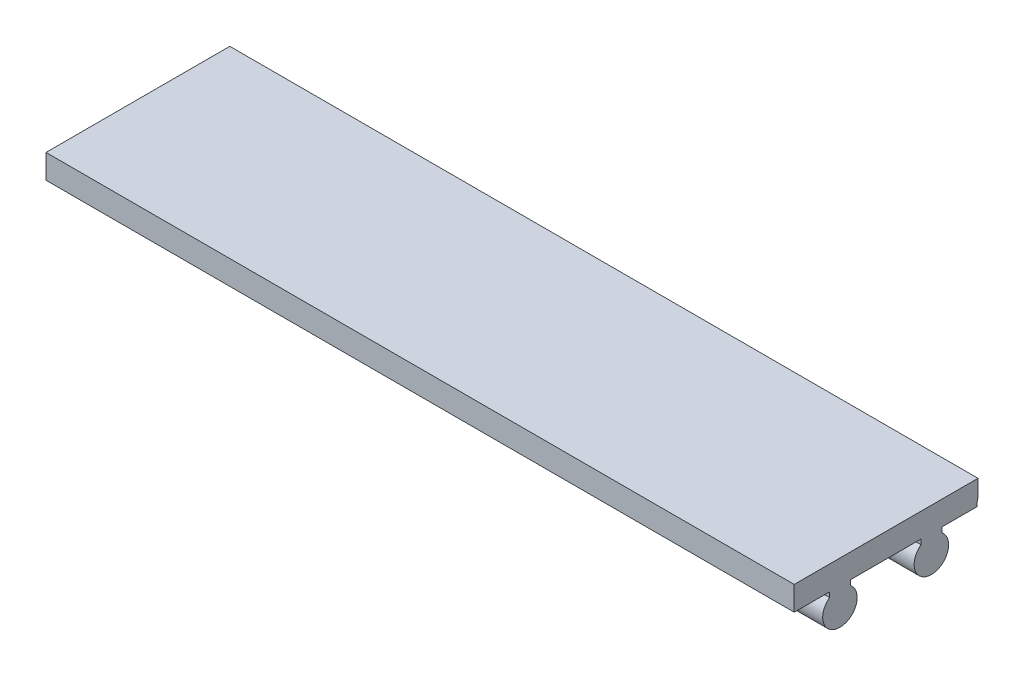
from build123d import *

# Parameters (mm, degrees)
EXTRUDE_1_DEPTH             = 90
SKETCH_2_W                  = 90
SKETCH_2_H                  = 17.75
EXTRUDE_2_DEPTH             = 8.2
SKETCH_3_W                  = 90
SKETCH_3_H                  = 50.95
EXTRUDE_3_DEPTH             = 8.2
SKETCH_4_W                  = 3.95
SKETCH_4_H                  = 29.5
CUT_EXTRUDE_1_DEPTH         = 96.44153315
SKETCH_5_W                  = 3.95
SKETCH_5_H                  = 6.2
CUT_EXTRUDE_2_DEPTH         = 96.44153315
SKETCH_6_W                  = 2.25
SKETCH_6_H                  = 3.95
CUT_EXTRUDE_3_DEPTH         = 96.44153315
SKETCH_7_W                  = 4.5
SKETCH_7_H                  = 3.95
CUT_EXTRUDE_4_DEPTH         = 96.44153315
SKETCH_8_W                  = 2.25
SKETCH_8_H                  = 3.95
CUT_EXTRUDE_5_DEPTH         = 96.44153315
SKETCH_9_W                  = 3.95
SKETCH_9_H                  = 2.25
CUT_EXTRUDE_6_DEPTH         = 96.44153315
SKETCH_10_W                 = 20.2
SKETCH_10_H                 = 45.2
CUT_EXTRUDE_7_DEPTH         = 86
HOLE_WIZARD_2_5_2_5_1_D     = 2.5
HOLE_WIZARD_4_5_4_5_1_D     = 4.5
HOLE_WIZARD_8_3_8_3_1_D     = 8.3
HOLE_WIZARD_8_3_8_3_1_DEPTH = 3.2
FILLET_1_R                  = 2
FILLET_2_R                  = 2
EXTRUDE_START               = -90
SKETCH_17_R                 = 1.25
EXTRUDE_4_DEPTH             = 90
CUT_EXTRUDE_START           = -100
SKETCH_18_R                 = 4.15
CUT_EXTRUDE_8_DEPTH         = 100
CUT_EXTRUDE_9_DEPTH         = 106
SKETCH_20_W                 = 90
SKETCH_20_H                 = 22.108571968
EXTRUDE_5_DEPTH             = 2


with BuildPart() as part:
    # Эскиз1 → Бобышка-Вытянуть1 (new body)
    with BuildSketch(Plane(origin=(90, 0, 0), x_dir=(0, 0, -1), z_dir=(1, 0, 0))):
        with BuildLine():
            Line((6.75, -24.093761792), (6.75, 19.25))
            Line((6.75, 19.25), (-11.593761792, 19.25))
            ThreePointArc((-11.593761792, 19.25), (-15.325, 18), (-11.593761792, 16.75))
            Line((-11.593761792, 16.75), (-11, 16.75))
            Line((-11, 16.75), (-11, -16.75))
            Line((-11, -16.75), (-11.593761792, -16.75))
            ThreePointArc((-11.593761792, -16.75), (-15.325, -18), (-11.593761792, -19.25))
            Line((-11.593761792, -19.25), (-11, -19.25))
            Line((-11, -19.25), (-11, -23.5))
            Line((-11, -23.5), (-6.75, -23.5))
            Line((-6.75, -23.5), (-6.75, -24.093761792))
            ThreePointArc((-6.75, -24.093761792), (-5.5, -27.825), (-4.25, -24.093761792))
            Line((-4.25, -24.093761792), (-4.25, -23.5))
            Line((-4.25, -23.5), (4.25, -23.5))
            Line((4.25, -23.5), (4.25, -24.093761792))
            ThreePointArc((4.25, -24.093761792), (5.5, -27.825), (6.75, -24.093761792))
        make_face()
    extrude(amount=-EXTRUDE_1_DEPTH)

    # Эскиз2 → Бобышка-Вытянуть2 (add)
    with BuildSketch(Plane(origin=(0, 19.25, 0), x_dir=(-1, 0, 0), z_dir=(0, 1, 0))):
        with Locations((-45, 2.125)):
            Rectangle(SKETCH_2_W, SKETCH_2_H)
    extrude(amount=EXTRUDE_2_DEPTH)

    # Эскиз3 → Бобышка-Вытянуть3 (add)
    with BuildSketch(Plane(origin=(0, 0, -6.75), x_dir=(-1, 0, 0), z_dir=(0, 0, -1))):
        with Locations((-45, 1.975)):
            Rectangle(SKETCH_3_W, SKETCH_3_H)
    extrude(amount=EXTRUDE_3_DEPTH)

    # Эскиз4 → Вырез-Вытянуть1 (cut, through all)
    with BuildSketch(Plane.ZY):
        with Locations((-12.975, 0)):
            Rectangle(SKETCH_4_W, SKETCH_4_H)
    extrude(amount=-CUT_EXTRUDE_1_DEPTH, mode=Mode.SUBTRACT)

    # Эскиз5 → Вырез-Вытянуть2 (cut, through all)
    with BuildSketch(Plane.ZY):
        with Locations((-12.975, 24.35)):
            Rectangle(SKETCH_5_W, SKETCH_5_H)
    extrude(amount=-CUT_EXTRUDE_2_DEPTH, mode=Mode.SUBTRACT)

    # Эскиз6 → Вырез-Вытянуть3 (cut, through all)
    with BuildSketch(Plane.ZY):
        with Locations((-9.875, 25.475)):
            Rectangle(SKETCH_6_W, SKETCH_6_H)
    extrude(amount=-CUT_EXTRUDE_3_DEPTH, mode=Mode.SUBTRACT)

    # Эскиз7 → Вырез-Вытянуть4 (cut, through all)
    with BuildSketch(Plane.ZY):
        with Locations((0, 25.475)):
            Rectangle(SKETCH_7_W, SKETCH_7_H)
    extrude(amount=-CUT_EXTRUDE_4_DEPTH, mode=Mode.SUBTRACT)

    # Эскиз8 → Вырез-Вытянуть5 (cut, through all)
    with BuildSketch(Plane.ZY):
        with Locations((9.875, 25.475)):
            Rectangle(SKETCH_8_W, SKETCH_8_H)
    extrude(amount=-CUT_EXTRUDE_5_DEPTH, mode=Mode.SUBTRACT)

    # Эскиз9 → Вырез-Вытянуть6 (cut, through all)
    with BuildSketch(Plane.ZY):
        with Locations((-12.975, -22.375)):
            Rectangle(SKETCH_9_W, SKETCH_9_H)
    extrude(amount=-CUT_EXTRUDE_6_DEPTH, mode=Mode.SUBTRACT)

    # Эскиз10 → Вырез-Вытянуть7 (cut)
    with BuildSketch(Plane(origin=(90, 0, 0), x_dir=(0, 0, -1), z_dir=(1, 0, 0))):
        Rectangle(SKETCH_10_W, SKETCH_10_H)
    extrude(amount=-CUT_EXTRUDE_7_DEPTH, mode=Mode.SUBTRACT)

    # Диаметр отверстия Ø2.5 (2.5)1 (through all)
    with Locations(Plane(origin=(90, 0, 0), x_dir=(0, 0, -1), z_dir=(1, 0, 0))):
        with Locations((5.5, -25.75), (-13.25, -18), (-5.5, -25.75), (-13.25, 18)):
            Hole(HOLE_WIZARD_2_5_2_5_1_D / 2)

    # Диаметр отверстия Ø4.5 (4.5)1 (through all)
    with Locations(Plane.ZY):
        with Locations((-13.25, -18), (-13.25, 18), (-5.5, 25.75), (5.5, 25.75)):
            Hole(HOLE_WIZARD_4_5_4_5_1_D / 2)

    # Диаметр отверстия Ø8.3 (8.3)1
    with Locations(Plane.ZY):
        with Locations((0, 0)):
            Hole(HOLE_WIZARD_8_3_8_3_1_D / 2, depth=HOLE_WIZARD_8_3_8_3_1_DEPTH)

    # Скругление1
    fillet_1_edges = [part.edges().sort_by_distance(p)[0] for p in [
        (45, 23.5, 8.75),
    ]]
    fillet(fillet_1_edges, radius=FILLET_1_R)

    # Скругление2
    fillet_2_edges = [part.edges().sort_by_distance(p)[0] for p in [
        (45, 23.5, -8.75),
        (45, 23.5, 2.25),
        (45, 23.5, -2.25),
        (45, -21.25, -11),
        (4, 0, -10.1),
        (4, -22.6, 0),
        (4, 0, 10.1),
        (4, 22.6, 0),
        (45, 14.75, -11),
        (45, -14.75, -11),
        (45, 21.25, -11),
    ]]
    fillet(fillet_2_edges, radius=FILLET_2_R)

    # Эскиз17 → Бобышка-Вытянуть4 (add)
    with BuildSketch(Plane(origin=(90, 0, 0), x_dir=(0, 0, -1), z_dir=(1, 0, 0)).offset(EXTRUDE_START)):
        with Locations((5.5, -25.75)):
            Circle(SKETCH_17_R)
        with Locations((-5.5, -25.75)):
            Circle(SKETCH_17_R)
        with Locations((-13.25, -18)):
            Circle(SKETCH_17_R)
        with Locations((-13.25, 18)):
            Circle(SKETCH_17_R)
    extrude(amount=EXTRUDE_4_DEPTH)

    # Эскиз18 → Вырез-Вытянуть8 (cut)
    with BuildSketch(Plane.ZY.offset(CUT_EXTRUDE_START)):
        Circle(SKETCH_18_R)
    extrude(amount=CUT_EXTRUDE_8_DEPTH, mode=Mode.SUBTRACT)

    # Эскиз19 → Вырез-Вытянуть9 (cut)
    with BuildSketch(Plane(origin=(90, 0, 0), x_dir=(0, 0, -1), z_dir=(1, 0, 0))):
        Polygon((10.1, -22.6), (-10.1, -22.6), (-27.028488592, -22.6), (-27.028488592, 40.291612525), (29.6277603, 40.291612525), (29.6277603, -22.6), align=None)
    extrude(amount=-CUT_EXTRUDE_9_DEPTH, mode=Mode.SUBTRACT)

    # Эскиз20 → Бобышка-Вытянуть5 (add)
    with BuildSketch(Plane(origin=(0, -22.6, 0), x_dir=(1, 0, 0), z_dir=(0, 1, 0))):
        with Locations((45, 0.054285984)):
            Rectangle(SKETCH_20_W, SKETCH_20_H)
    extrude(amount=EXTRUDE_5_DEPTH)


solid = part.part
